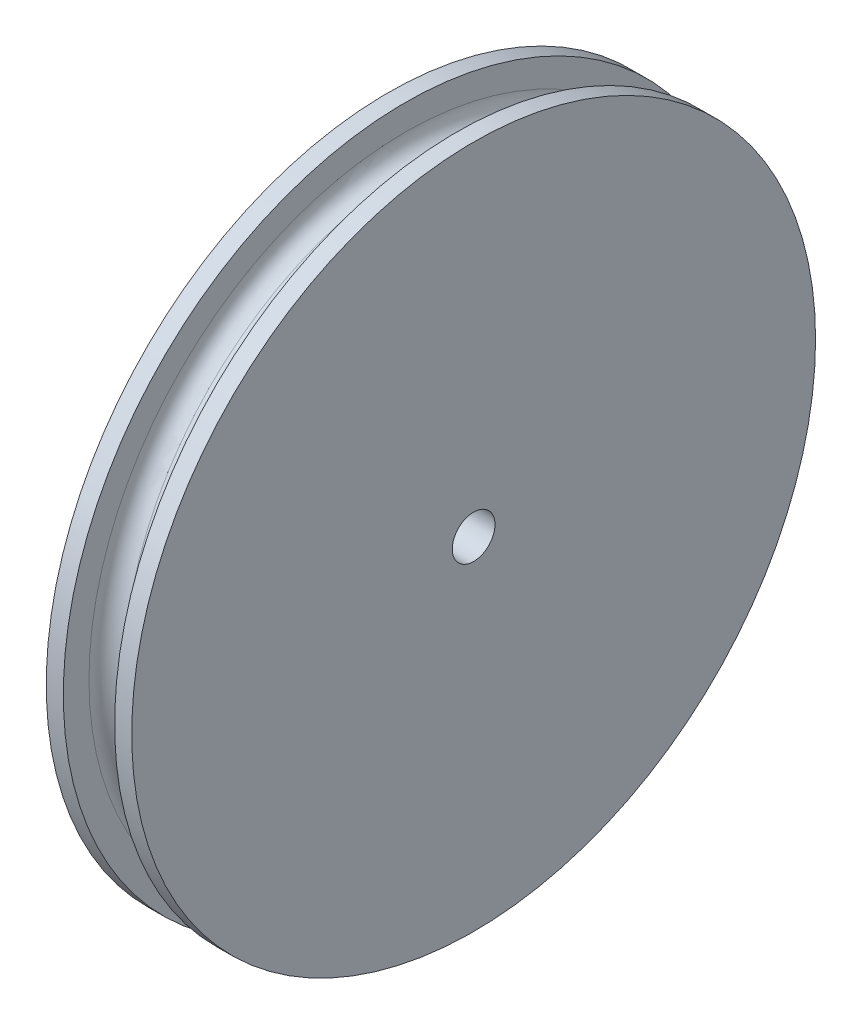
from build123d import *

# Parameters (mm, degrees)
SKETCH1_R           = 50.8
SKETCH1_R_2         = 3.175
SKETCH1_R_3         = 44.45
BOSS_EXTRUDE1_DEPTH = 6.35
SKETCH1_3_R         = 50.8
SKETCH1_3_R_2       = 44.45
CUT_EXTRUDE1_DEPTH  = 3.81
FILLET1_R           = 2.54


with BuildPart() as part:
    # Sketch1 → Boss-Extrude1 (new, symmetric)
    # profile 1 of 2: a face of its own
    with BuildSketch(Plane(origin=(0, 0, 0), x_dir=(0, 0, -1), z_dir=(1, 0, 0))):
        Circle(SKETCH1_R)
        Circle(SKETCH1_R_2, mode=Mode.SUBTRACT)
    # profile 2 of 2: a face of its own
    with BuildSketch(Plane(origin=(0, 0, 0), x_dir=(0, 0, -1), z_dir=(1, 0, 0))):
        Circle(SKETCH1_R)
        Circle(SKETCH1_R_3, mode=Mode.SUBTRACT)
    extrude(amount=BOSS_EXTRUDE1_DEPTH, both=True)

    # Sketch1<3> → Cut-Extrude1 (cut, symmetric)
    with BuildSketch(Plane(origin=(0, 0, 0), x_dir=(0, 0, -1), z_dir=(1, 0, 0))):
        Circle(SKETCH1_3_R)
        Circle(SKETCH1_3_R_2, mode=Mode.SUBTRACT)
    extrude(amount=CUT_EXTRUDE1_DEPTH, both=True, mode=Mode.SUBTRACT)

    # Fillet1
    fillet1_edges = [part.edges().sort_by_distance(p)[0] for p in [
        (-3.81, 0, 44.45),
        (3.81, 0, 44.45),
    ]]
    fillet(fillet1_edges, radius=FILLET1_R)


solid = part.part
